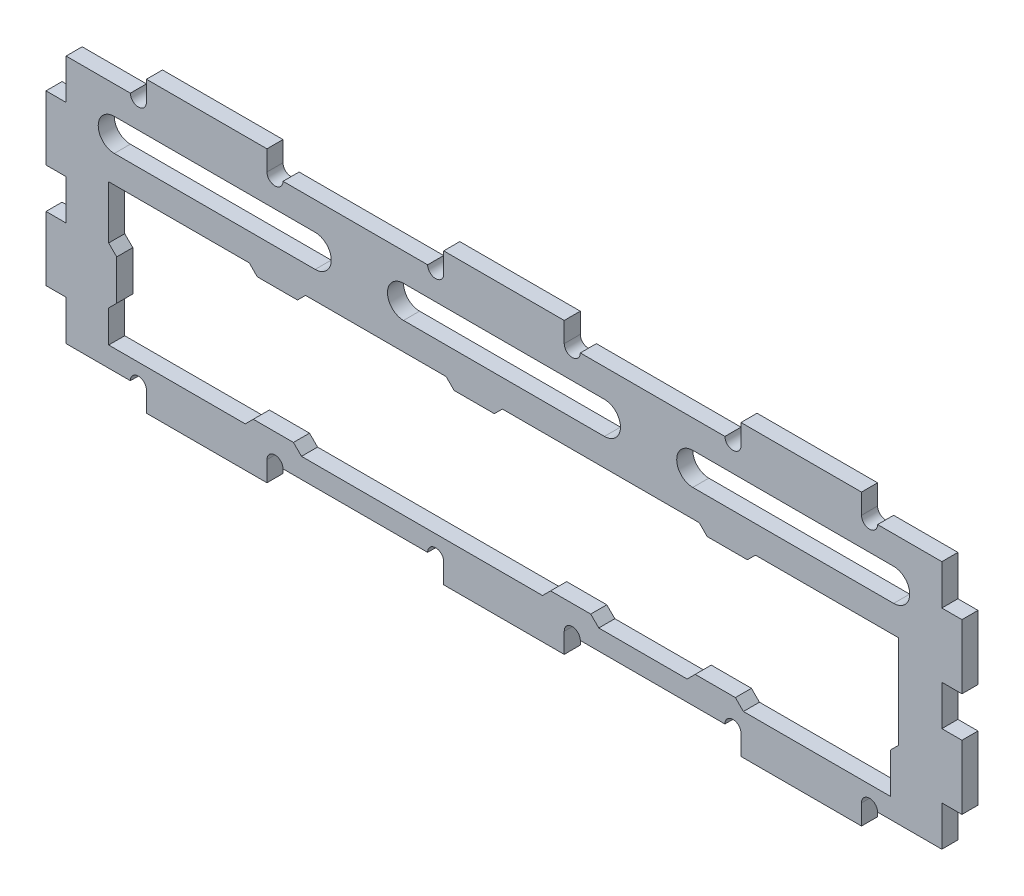
from build123d import *

# Parameters (mm, degrees)
SKETCH_1_W          = 109
SKETCH_1_H          = 31
EXTRUDE_1_DEPTH     = 2
SKETCH_2_W          = 2.5
SKETCH_2_H          = 8
EXTRUDE_2_DEPTH     = 2
SKETCH_3_W          = 15
SKETCH_3_H          = 2.5
EXTRUDE_3_DEPTH     = 2
CUT_EXTRUDE_1_DEPTH = 117.44097217
CUT_EXTRUDE_2_DEPTH = 117.44097217


with BuildPart() as part:
    # 草图1 → 凸台-拉伸1 (new body)
    with BuildSketch(Plane.XY):
        with Locations((54.5, 15.5)):
            Rectangle(SKETCH_1_W, SKETCH_1_H)
        Polygon((23.3, 3.5), (28.3, 3.5), (29.3, 2.5), (59.3, 2.5), (60.3, 3.5), (65.3, 3.5), (66.3, 2.5), (77.3, 2.5), (78.3, 3.5), (83.3, 3.5), (84.3, 2.5), (102.6, 2.5), (102.6, 7.5), (103.6, 8.5), (103.6, 20.1), (85.8, 20.1), (84.8, 19.1), (79.8, 19.1), (78.8, 20.1), (54.3, 20.1), (53.3, 19.1), (48.3, 19.1), (47.3, 20.1), (29.8, 20.1), (28.8, 19.1), (23.8, 19.1), (22.8, 20.1), (5.3, 20.1), (5.3, 13.5), (6.3, 12.5), (6.3, 7.5), (5.3, 6.5), (5.3, 2.5), (22.3, 2.5), align=None, mode=Mode.SUBTRACT)
    extrude(amount=EXTRUDE_1_DEPTH)

    # 草图2 → 凸台-拉伸2 (add)
    with BuildSketch(Plane.XY.offset(2)):
        with Locations((-1.25, 22)):
            Rectangle(SKETCH_2_W, SKETCH_2_H)
        with Locations((-1.25, 9)):
            Rectangle(SKETCH_2_W, SKETCH_2_H)
        with Locations((110.25, 9)):
            Rectangle(SKETCH_2_W, SKETCH_2_H)
        with Locations((110.25, 22)):
            Rectangle(SKETCH_2_W, SKETCH_2_H)
    extrude(amount=-EXTRUDE_2_DEPTH)

    # 草图3 → 凸台-拉伸3 (add)
    with BuildSketch(Plane.XY.offset(2)):
        with Locations((17.5, 32.25)):
            Rectangle(SKETCH_3_W, SKETCH_3_H)
        with Locations((54.5, 32.25)):
            Rectangle(SKETCH_3_W, SKETCH_3_H)
        with Locations((91.5, 32.25)):
            Rectangle(SKETCH_3_W, SKETCH_3_H)
        with Locations((91.5, -1.25)):
            Rectangle(SKETCH_3_W, SKETCH_3_H)
        with Locations((54.5, -1.25)):
            Rectangle(SKETCH_3_W, SKETCH_3_H)
        with Locations((17.5, -1.25)):
            Rectangle(SKETCH_3_W, SKETCH_3_H)
    extrude(amount=-EXTRUDE_3_DEPTH)

    # 草图4 → 切除-拉伸1 (cut, through all)
    with BuildSketch(Plane.XY.offset(2)):
        with BuildLine():
            Line((8, 31), (10, 31))
            ThreePointArc((10, 31), (9, 30), (8, 31))
        make_face()
        with BuildLine():
            Line((27, 31), (25, 31))
            ThreePointArc((25, 31), (26, 30), (27, 31))
        make_face()
        with BuildLine():
            Line((45, 31), (47, 31))
            ThreePointArc((47, 31), (46, 30), (45, 31))
        make_face()
        with BuildLine():
            Line((64, 31), (62, 31))
            ThreePointArc((62, 31), (63, 30), (64, 31))
        make_face()
        with BuildLine():
            Line((82, 31), (84, 31))
            ThreePointArc((84, 31), (83, 30), (82, 31))
        make_face()
        with BuildLine():
            Line((101, 31), (99, 31))
            ThreePointArc((99, 31), (100, 30), (101, 31))
        make_face()
        with BuildLine():
            Line((101, 0), (99, 0))
            ThreePointArc((99, 0), (100, 1), (101, 0))
        make_face()
        with BuildLine():
            Line((82, 0), (84, 0))
            ThreePointArc((84, 0), (83, 1), (82, 0))
        make_face()
        with BuildLine():
            Line((64, 0), (62, 0))
            ThreePointArc((62, 0), (63, 1), (64, 0))
        make_face()
        with BuildLine():
            Line((45, 0), (47, 0))
            ThreePointArc((47, 0), (46, 1), (45, 0))
        make_face()
        with BuildLine():
            Line((27, 0), (25, 0))
            ThreePointArc((25, 0), (26, 1), (27, 0))
        make_face()
        with BuildLine():
            Line((8, 0), (10, 0))
            ThreePointArc((10, 0), (9, 1), (8, 0))
        make_face()
    extrude(amount=-CUT_EXTRUDE_1_DEPTH, mode=Mode.SUBTRACT)

    # 草图5 → 切除-拉伸2 (cut, through all)
    with BuildSketch(Plane.XY.offset(2)):
        with BuildLine():
            Line((6, 27.5), (31, 27.5))
            ThreePointArc((31, 27.5), (33, 25.5), (31, 23.5))
            Line((31, 23.5), (6, 23.5))
            ThreePointArc((6, 23.5), (4, 25.5), (6, 27.5))
        make_face()
        with BuildLine():
            Line((42, 27.5), (67, 27.5))
            ThreePointArc((67, 27.5), (69, 25.5), (67, 23.5))
            Line((67, 23.5), (42, 23.5))
            ThreePointArc((42, 23.5), (40, 25.5), (42, 27.5))
        make_face()
        with BuildLine():
            Line((78, 27.5), (103, 27.5))
            ThreePointArc((103, 27.5), (105, 25.5), (103, 23.5))
            Line((103, 23.5), (78, 23.5))
            ThreePointArc((78, 23.5), (76, 25.5), (78, 27.5))
        make_face()
    extrude(amount=-CUT_EXTRUDE_2_DEPTH, mode=Mode.SUBTRACT)


solid = part.part
